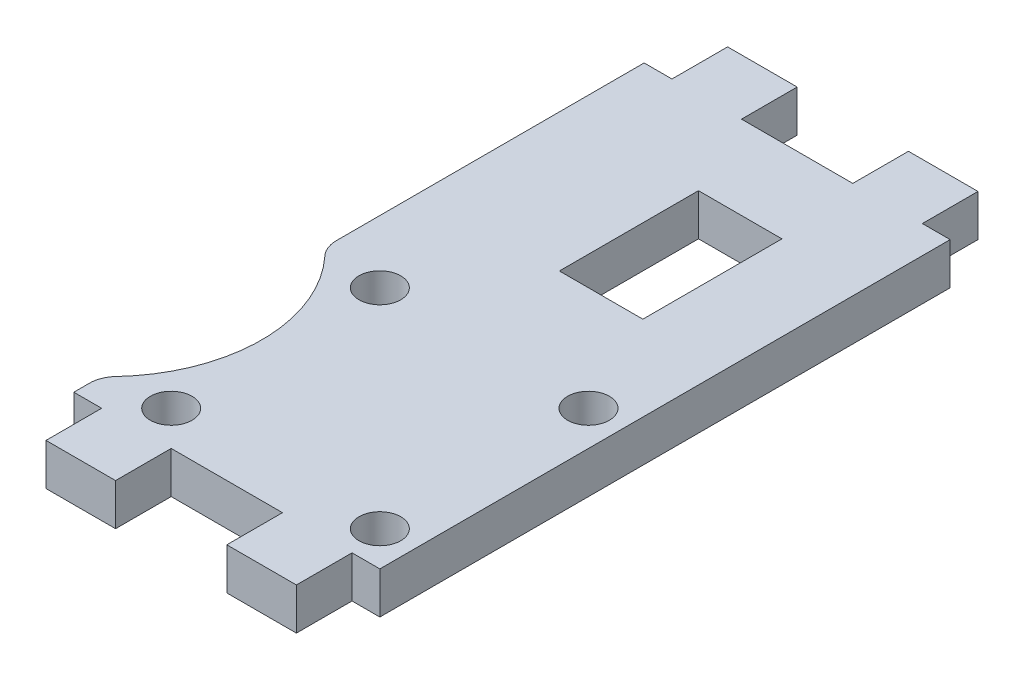
from build123d import *

# Parameters (mm, degrees)
SKETCH_1_W          = 22
SKETCH_1_H          = 41
EXTRUDE_1_DEPTH     = 3
SKETCH_2_W          = 5
SKETCH_2_H          = 4
EXTRUDE_2_DEPTH     = 3
SKETCH_3_W          = 6
SKETCH_3_H          = 10
CUT_EXTRUDE_1_DEPTH = 10
SKETCH_4_R          = 1.5
CUT_EXTRUDE_2_DEPTH = 10
SKETCH_5_R          = 11
CUT_EXTRUDE_3_DEPTH = 10
FILLET_1_R          = 2


with BuildPart() as part:
    # 草图1 → 凸台-拉伸1 (new body)
    with BuildSketch(Plane(origin=(0, 0, 0), x_dir=(1, 0, 0), z_dir=(0, 1, 0))):
        Rectangle(SKETCH_1_W, SKETCH_1_H)
    extrude(amount=EXTRUDE_1_DEPTH)

    # 草图2 → 凸台-拉伸2 (add)
    with BuildSketch(Plane(origin=(0, 3, 0), x_dir=(1, 0, 0), z_dir=(0, 1, 0))):
        with Locations((-6.5, 22.5)):
            Rectangle(SKETCH_2_W, SKETCH_2_H)
        with Locations((6.5, 22.5)):
            Rectangle(SKETCH_2_W, SKETCH_2_H)
        with Locations((6.5, -22.5)):
            Rectangle(SKETCH_2_W, SKETCH_2_H)
        with Locations((-6.5, -22.5)):
            Rectangle(SKETCH_2_W, SKETCH_2_H)
    extrude(amount=-EXTRUDE_2_DEPTH)

    # 草图3 → 切除-拉伸1 (cut)
    with BuildSketch(Plane.XZ):
        with Locations((1.906204118, -9.5)):
            Rectangle(SKETCH_3_W, SKETCH_3_H)
    extrude(amount=-CUT_EXTRUDE_1_DEPTH, mode=Mode.SUBTRACT)

    # 草图4 → 切除-拉伸2 (cut)
    with BuildSketch(Plane.XZ):
        with Locations(Location((-6.5, 18, 0), (0, 0, 270))):
            Circle(SKETCH_4_R)
        with Locations(Location((8.5, 18, 0), (0, 0, 270))):
            Circle(SKETCH_4_R)
        with Locations(Location((-6.5, 3, 0), (0, 0, 270))):
            Circle(SKETCH_4_R)
        with Locations(Location((8.5, 3, 0), (0, 0, 270))):
            Circle(SKETCH_4_R)
    extrude(amount=-CUT_EXTRUDE_2_DEPTH, mode=Mode.SUBTRACT)

    # 草图5 → 切除-拉伸3 (cut)
    with BuildSketch(Plane.XZ):
        with Locations((-18.5, 10.5)):
            Circle(SKETCH_5_R)
    extrude(amount=-CUT_EXTRUDE_3_DEPTH, mode=Mode.SUBTRACT)

    # 圆角1
    fillet_1_edges = [part.edges().sort_by_distance(p)[0] for p in [
        (-11, 1.5, 18.54673847),
        (-11, 1.5, 2.45326153),
    ]]
    fillet(fillet_1_edges, radius=FILLET_1_R)


solid = part.part
